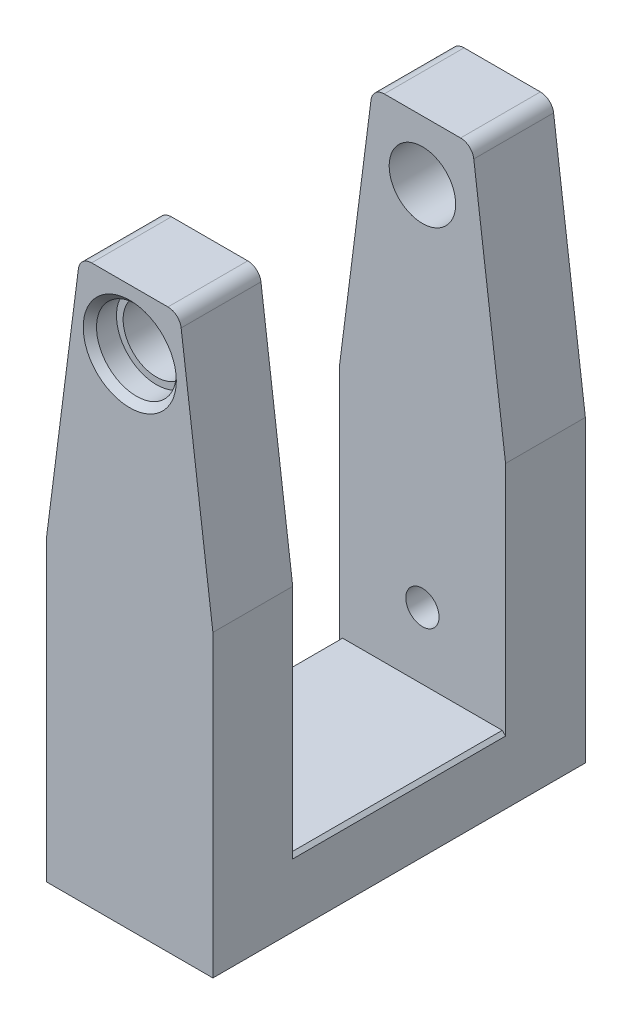
from build123d import *

# Parameters (mm, degrees)
BOSS_EXTRUDE1_DEPTH         = 28
SKETCH2_W                   = 32
SKETCH2_H                   = 74
CUT_EXTRUDE1_DEPTH          = 56
FILLET1_R                   = 2
CHAMFER1_SIZE               = 0.5
M6_TAPPED_HOLE2_D           = 5
M6_TAPPED_HOLE2_DEPTH       = 27
M6_TAPPED_HOLE2_CSINK_D     = 6.05
M6_TAPPED_HOLE2_CSINK_ANGLE = 90
M6_TAPPED_HOLE2_TIP         = 1.502151548


with BuildPart() as part:
    # Sketch1 → Boss-Extrude1 (new, symmetric)
    with BuildSketch(Plane.XY):
        Polygon((12.5, 0), (-12.5, 0), (-12.5, 45), (-7.5, 84), (7.5, 84), (12.5, 45), align=None)
    extrude(amount=BOSS_EXTRUDE1_DEPTH, both=True)

    # Sketch2 → Cut-Extrude1 (cut)
    with BuildSketch(Plane(origin=(12.5, 0, 0), x_dir=(0, 0, -1), z_dir=(1, 0, 0))):
        with Locations((0, 47)):
            Rectangle(SKETCH2_W, SKETCH2_H)
    extrude(amount=-CUT_EXTRUDE1_DEPTH, mode=Mode.SUBTRACT)

    # Sketch4 → CBORE for M4 Hex Socket Head Cap Screw1 (revolve, cut)
    with BuildSketch(Plane(origin=(0, 75, -28), x_dir=(0, 1, 0), z_dir=(1, 0, 0))):
        Polygon((0, 0), (0, 23.004303095), (5, 20), (5, 4), (6, 4), (6, 1), (7, 0), align=None)
    cbore_for_m4_hex_socket_head_cap_screw1 = revolve(axis=Axis((0, 75, -34.35), (0, 0, 1)), mode=Mode.SUBTRACT)

    # Mirror1: CBORE for M4 Hex Socket Head Cap Screw1 across plane
    add(cbore_for_m4_hex_socket_head_cap_screw1.mirror(Plane.XY), mode=Mode.SUBTRACT)

    # Fillet1
    fillet1_edges = [part.edges().sort_by_distance(p)[0] for p in [
        (-7.5, 84, 22),
        (7.5, 84, 22),
        (-7.5, 84, -22),
        (7.5, 84, -22),
    ]]
    fillet(fillet1_edges, radius=FILLET1_R)

    # Chamfer1
    chamfer1_edges = [part.edges().sort_by_distance(p)[0] for p in [
        (-12.5, 10, 0),
        (12.5, 10, 0),
    ]]
    chamfer(chamfer1_edges, length=CHAMFER1_SIZE)

    # M6 Tapped Hole2
    with Locations(Plane(origin=(0, 0, -28), x_dir=(-1, 0, 0), z_dir=(0, 0, -1))):
        with Locations((0, 20)):
            CounterSinkHole(M6_TAPPED_HOLE2_D / 2, M6_TAPPED_HOLE2_CSINK_D / 2, depth=M6_TAPPED_HOLE2_DEPTH, counter_sink_angle=M6_TAPPED_HOLE2_CSINK_ANGLE)
            with Locations((0, 0, -(M6_TAPPED_HOLE2_DEPTH + M6_TAPPED_HOLE2_TIP / 2))):  # 118° drill point
                Cone(0, M6_TAPPED_HOLE2_D / 2, M6_TAPPED_HOLE2_TIP, mode=Mode.SUBTRACT)


solid = part.part
